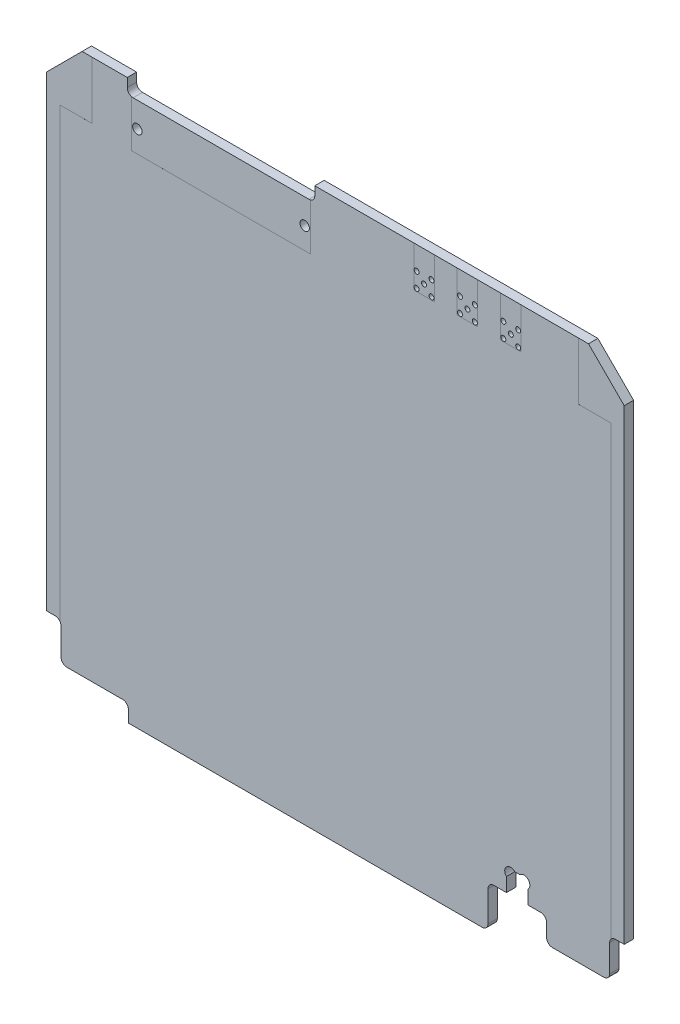
from build123d import *

# Parameters (mm, degrees)
SKETCH1_R           = 0.425
SKETCH1_R_2         = 0.8
BOSS_EXTRUDE1_DEPTH = 1.6
CUT_EXTRUDE1_DEPTH  = 0.0001
CUT_EXTRUDE2_DEPTH  = 0.0001
PARTFOOTPRINTS_W    = 30.48
PARTFOOTPRINTS_H    = 7.989227112
PARTFOOTPRINTS_W_2  = 3.5
PARTFOOTPRINTS_H_2  = 6.95
CUT_EXTRUDE3_DEPTH  = 0.0001
CUT_EXTRUDE4_DEPTH  = 71.235674696
SKETCH3_W           = 7.779754111
SKETCH3_H           = 5.155241991
CUT_EXTRUDE5_DEPTH  = 10
FILLET1_R           = 1


with BuildPart() as part:
    # Sketch1 → Boss-Extrude1 (new body)
    with BuildSketch(Plane(origin=(0, 0, -0.0125), x_dir=(-1, 0, 0), z_dir=(0, 0, -1))):
        with BuildLine():
            Line((35.3, -50), (35.3, -48))
            ThreePointArc((35.3, -48), (35.592893219, -47.292893219), (36.3, -47))
            Line((36.3, -47), (45.8, -47))
            ThreePointArc((45.8, -47), (46.507106781, -46.707106781), (46.8, -46))
            Line((46.8, -46), (46.8, -41.4))
            ThreePointArc((46.8, -41.4), (47.092893219, -40.692893219), (47.8, -40.4))
            Line((47.8, -40.4), (49.3, -40.4))
            Line((49.3, -40.4), (49.3, 39.2))
            Line((49.3, 39.2), (43.2, 45.3))
            Line((43.2, 45.3), (35.500000002, 45.3))
            Line((35.500000002, 45.3), (35.500000002, 43.8))
            ThreePointArc((35.500000002, 43.8), (35.207106783, 43.092893219), (34.500000002, 42.8))
            Line((34.500000002, 42.8), (4.499999998, 42.8))
            ThreePointArc((4.499999998, 42.8), (3.792893217, 43.092893219), (3.499999998, 43.8))
            Line((3.499999998, 43.8), (3.499999998, 45.3))
            Line((3.499999998, 45.3), (-43.2, 45.3))
            Line((-43.2, 45.3), (-49.3, 39.2))
            Line((-49.3, 39.2), (-49.3, -40.4))
            Line((-49.3, -40.4), (-47.8, -40.4))
            ThreePointArc((-47.8, -40.4), (-47.092893219, -40.692893219), (-46.8, -41.4))
            Line((-46.8, -41.4), (-46.8, -46))
            ThreePointArc((-46.8, -46), (-46.507106781, -46.707106781), (-45.8, -47))
            Line((-45.8, -47), (-36.3, -47))
            ThreePointArc((-36.3, -47), (-35.592893219, -47.292893219), (-35.3, -48))
            Line((-35.3, -48), (-35.3, -50))
            Line((-35.3, -50), (35.3, -50))
        make_face()
        with Locations(Location((-21.27, 41.37, 0), (0, 0, 180))):
            Circle(SKETCH1_R, mode=Mode.SUBTRACT)
        with Locations(Location((-23.81, 41.37, 0), (0, 0, 180))):
            Circle(SKETCH1_R, mode=Mode.SUBTRACT)
        with Locations(Location((-22.54, 40.1, 0), (0, 0, 180))):
            Circle(SKETCH1_R, mode=Mode.SUBTRACT)
        with Locations(Location((-13.87, 41.37, 0), (0, 0, 180))):
            Circle(SKETCH1_R, mode=Mode.SUBTRACT)
        with Locations(Location((-23.81, 38.83, 0), (0, 0, 180))):
            Circle(SKETCH1_R, mode=Mode.SUBTRACT)
        with Locations(Location((-16.41, 41.37, 0), (0, 0, 180))):
            Circle(SKETCH1_R, mode=Mode.SUBTRACT)
        with Locations(Location((-15.14, 40.1, 0), (0, 0, 180))):
            Circle(SKETCH1_R, mode=Mode.SUBTRACT)
        with Locations(Location((-21.27, 38.83, 0), (0, 0, 180))):
            Circle(SKETCH1_R, mode=Mode.SUBTRACT)
        with Locations(Location((-28.67, 41.37, 0), (0, 0, 180))):
            Circle(SKETCH1_R, mode=Mode.SUBTRACT)
        with Locations(Location((-31.21, 41.37, 0), (0, 0, 180))):
            Circle(SKETCH1_R, mode=Mode.SUBTRACT)
        with Locations(Location((-16.41, 38.83, 0), (0, 0, 180))):
            Circle(SKETCH1_R, mode=Mode.SUBTRACT)
        with Locations(Location((-29.94, 40.1, 0), (0, 0, 180))):
            Circle(SKETCH1_R, mode=Mode.SUBTRACT)
        with Locations(Location((-31.21, 38.83, 0), (0, 0, 180))):
            Circle(SKETCH1_R, mode=Mode.SUBTRACT)
        with Locations(Location((-28.67, 38.83, 0), (0, 0, 180))):
            Circle(SKETCH1_R, mode=Mode.SUBTRACT)
        with Locations(Location((33.775, 38.54, 0), (0, 0, 180))):
            Circle(SKETCH1_R_2, mode=Mode.SUBTRACT)
        with Locations((5.225, 38.54)):
            Circle(SKETCH1_R_2, mode=Mode.SUBTRACT)
        with Locations(Location((-13.87, 38.83, 0), (0, 0, 180))):
            Circle(SKETCH1_R, mode=Mode.SUBTRACT)
    extrude(amount=-BOSS_EXTRUDE1_DEPTH)

    # thermalContacts_lower → Cut-Extrude1 (cut)
    with BuildSketch(Plane(origin=(0, 0, -0.0125), x_dir=(-1, 0, 0), z_dir=(0, 0, -1))):
        Polygon((47, 35.5), (47, -41.5), (59.827263463, -41.5), (59.827263463, 47), (41.5, 47), (41.5, 41.5), (41.5, 35.5), align=None)
        Polygon((-47, 35.5), (-47, -41.5), (-56.192158269, -41.5), (-56.192158269, 47), (-41.5, 47), (-41.5, 41.5), (-41.5, 35.5), align=None)
    extrude(amount=-CUT_EXTRUDE1_DEPTH, mode=Mode.SUBTRACT)

    # thermalContacts_upper → Cut-Extrude2 (cut)
    with BuildSketch(Plane.XY.offset(1.5875)):
        Polygon((-47, 35.5), (-47, -41.5), (-56.192158269, -41.5), (-56.192158269, 47), (-41.5, 47), (-41.5, 41.5), (-41.5, 35.5), align=None)
        Polygon((47, 35.5), (47, -41.5), (59.827263463, -41.5), (59.827263463, 47), (41.5, 47), (41.5, 41.5), (41.5, 35.5), align=None)
    extrude(amount=-CUT_EXTRUDE2_DEPTH, mode=Mode.SUBTRACT)

    # partFootprints → Cut-Extrude3 (cut)
    with BuildSketch(Plane.XY.offset(1.5875)):
        with Locations((-19.5, 38.834613556)):
            Rectangle(PARTFOOTPRINTS_W, PARTFOOTPRINTS_H)
        with Locations((15.14, 41.825)):
            Rectangle(PARTFOOTPRINTS_W_2, PARTFOOTPRINTS_H_2)
        with Locations((22.54, 41.825)):
            Rectangle(PARTFOOTPRINTS_W_2, PARTFOOTPRINTS_H_2)
        with Locations((29.94, 41.825)):
            Rectangle(PARTFOOTPRINTS_W_2, PARTFOOTPRINTS_H_2)
    extrude(amount=-CUT_EXTRUDE3_DEPTH, mode=Mode.SUBTRACT)

    # Sketch2 → Cut-Extrude4 (cut, through all)
    with BuildSketch(Plane.XY.offset(1.5875)):
        with BuildLine():
            Line((29.2, -42.8), (29.2, -40.414213562))
            ThreePointArc((29.2, -40.414213562), (29.2, -39), (30.614213562, -39))
            Line((30.614213562, -39), (31.485786438, -39))
            ThreePointArc((31.485786438, -39), (32.9, -39), (32.9, -40.414213562))
            Line((32.9, -40.414213562), (32.9, -42.8))
            Line((32.9, -42.8), (36.05, -42.8))
            Line((36.05, -42.8), (36.05, -50))
            Line((36.05, -50), (26.05, -50))
            Line((26.05, -50), (26.05, -42.8))
            Line((26.05, -42.8), (29.2, -42.8))
        make_face()
    extrude(amount=-CUT_EXTRUDE4_DEPTH, mode=Mode.SUBTRACT)

    # Sketch3 → Cut-Extrude5 (cut)
    with BuildSketch(Plane.XY.offset(1.5875)):
        with Locations((35.630924609, -49.577620995)):
            Rectangle(SKETCH3_W, SKETCH3_H)
    extrude(amount=-CUT_EXTRUDE5_DEPTH, mode=Mode.SUBTRACT)

    # Fillet1
    fillet1_edges = [part.edges().sort_by_distance(p)[0] for p in [
        (26.05, -50, 0.7875),
        (26.05, -42.8, 0.7875),
        (36.05, -42.8, 0.7875),
        (36.05, -47, 0.7875),
    ]]
    fillet(fillet1_edges, radius=FILLET1_R)


solid = part.part
